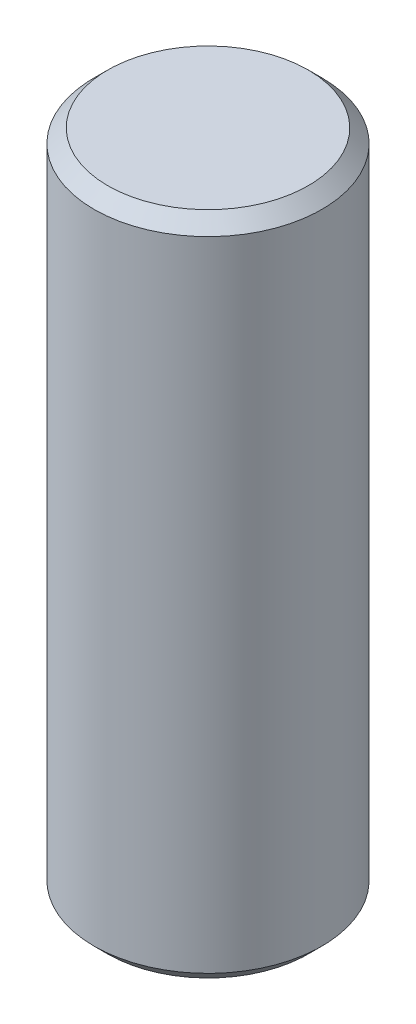
from build123d import *

# Parameters (mm, degrees)
SKETCH1_R           = 2.5
BOSS_EXTRUDE1_DEPTH = 14.6
CHAMFER1_SIZE       = 0.3


with BuildPart() as part:
    # Sketch1 → Boss-Extrude1 (new body)
    with BuildSketch(Plane(origin=(0, 0, 0), x_dir=(1, 0, 0), z_dir=(0, 1, 0))):
        with Locations(Location((0, 0, 0), (0, 0, 270))):
            Circle(SKETCH1_R)
    extrude(amount=BOSS_EXTRUDE1_DEPTH)

    # Chamfer1
    chamfer1_edges = [part.edges().sort_by_distance(p)[0] for p in [
        (0, 0, -2.5),
        (0, 14.6, -2.5),
    ]]
    chamfer(chamfer1_edges, length=CHAMFER1_SIZE)


solid = part.part
